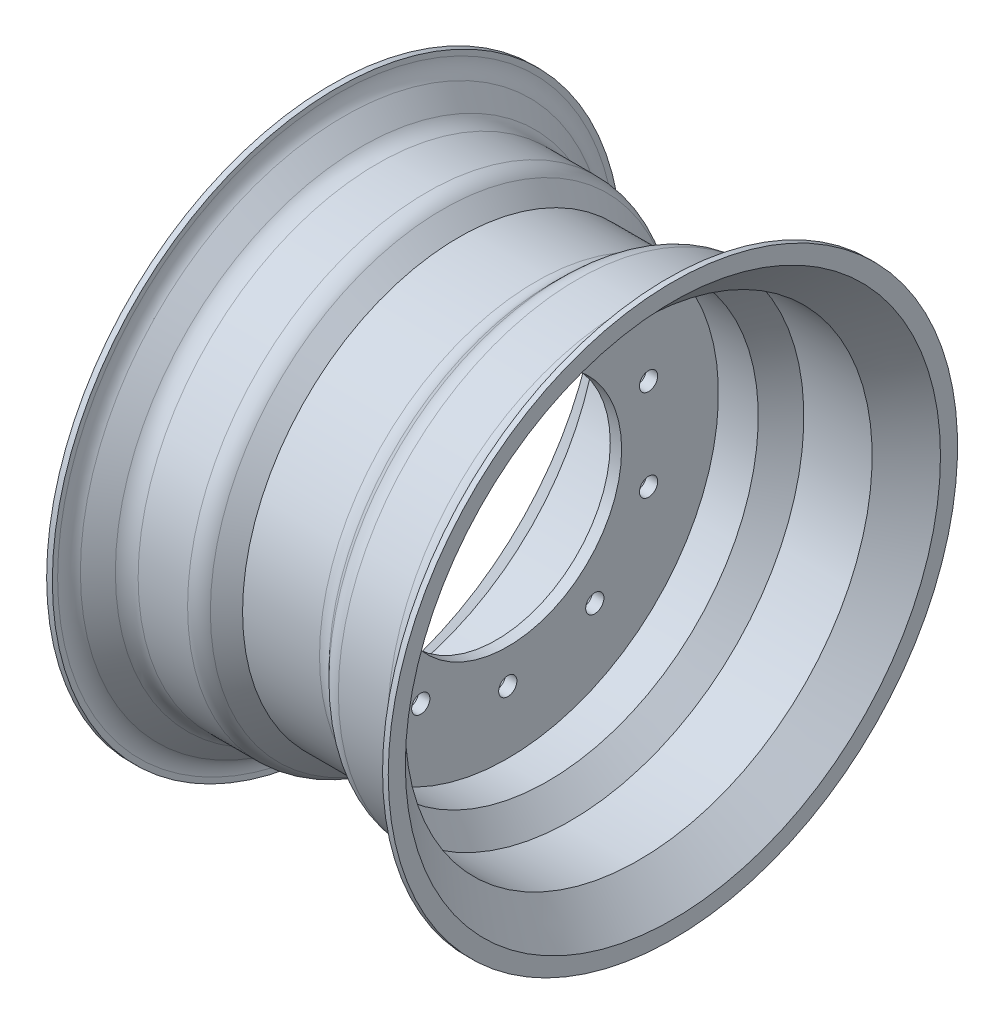
from build123d import *

# Parameters (mm, degrees)
FILLET1_R          = 20
SKETCH2_R          = 8
CUT_EXTRUDE1_DEPTH = 10
CIRPATTERN1_COUNT  = 10


with BuildPart() as part:
    # Sketch1 → Revolve1 (revolve)
    with BuildSketch(Plane.XY, mode=Mode.PRIVATE) as revolve1_sk:
        Polygon((-150, 250), (-150, 235), (-120, 205), (-60, 205), (-40, 185), (-5, 185), (-5, 100), (5, 100), (5, 185), (40, 185), (60, 205), (120, 205), (150, 235), (150, 250), (145, 250), (145, 237.071067812), (117.928932188, 210), (57.928932188, 210), (37.928932188, 190), (-37.928932188, 190), (-57.928932188, 210), (-117.928932188, 210), (-145, 237.071067812), (-145, 250), align=None)
    revolve(revolve1_sk.sketch.rotate(Axis((-343.890956764, 0, 0), (1, 0, 0)), 90), axis=Axis((-343.890956764, 0, 0), (1, 0, 0)))

    # Fillet1
    fillet1_edges = [part.edges().sort_by_distance(p)[0] for p in [
        (-40, 0, -185),
        (145, 0, -237.071067812),
        (117.928932188, 0, -210),
        (57.928932188, 0, -210),
        (37.928932188, 0, -190),
        (-57.928932188, 0, -210),
        (-117.928932188, 0, -210),
        (-145, 0, -237.071067812),
    ]]
    fillet(fillet1_edges, radius=FILLET1_R)

    # Sketch2 → Cut-Extrude1 (cut)
    with BuildSketch(Plane.ZY.offset(5)):
        with Locations((0, 130)):
            Circle(SKETCH2_R)
    cut_extrude1 = extrude(amount=-CUT_EXTRUDE1_DEPTH, mode=Mode.SUBTRACT)

    # CirPattern1: Cut-Extrude1 ×10 about axis
    cirpattern1_axis = Axis((0, 0, 0), (1, 0, 0))
    for i in range(1, CIRPATTERN1_COUNT):
        add(cut_extrude1.rotate(cirpattern1_axis, i * 360 / CIRPATTERN1_COUNT), mode=Mode.SUBTRACT)


solid = part.part
